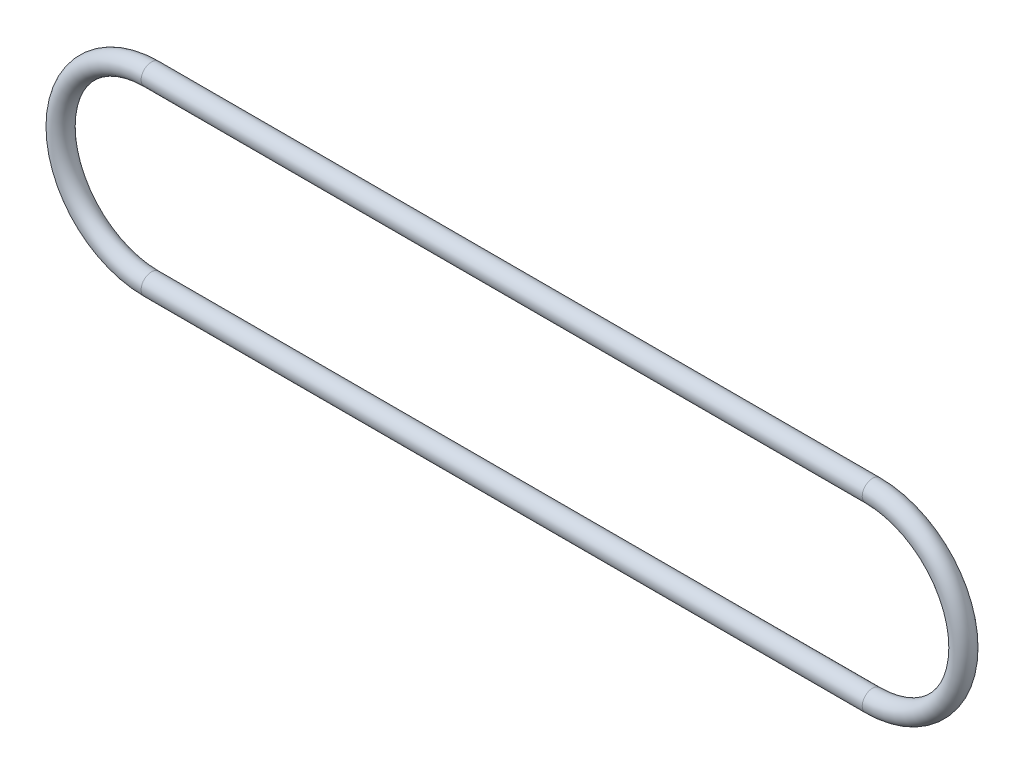
from build123d import *

# Parameters (mm, degrees)
SWEEP2_PROFILE_R = 12.5


with BuildPart() as part:
    # Sweep2: sweep along a path in Sketch1
    with BuildLine(Plane.XY) as sweep2_path:
        Line((-246.496907216, 271.559793814), (626.503092784, 271.559793814))
        ThreePointArc((626.503092784, 271.559793814), (736.503092784, 161.559793814), (626.503092784, 51.559793814))
        Line((626.503092784, 51.559793814), (-246.496907216, 51.559793814))
        ThreePointArc((-246.496907216, 51.559793814), (-356.496907216, 161.559793814), (-246.496907216, 271.559793814))
    # Sweep2 profile (on start of the path) → Sweep2 (sweep)
    with BuildSketch(Plane(origin=(-246.496907216, 271.559793814, 0), x_dir=(0, 1, 0), z_dir=(1, 0, 0))):
        Circle(SWEEP2_PROFILE_R)
    sweep(path=sweep2_path.line)


solid = part.part
